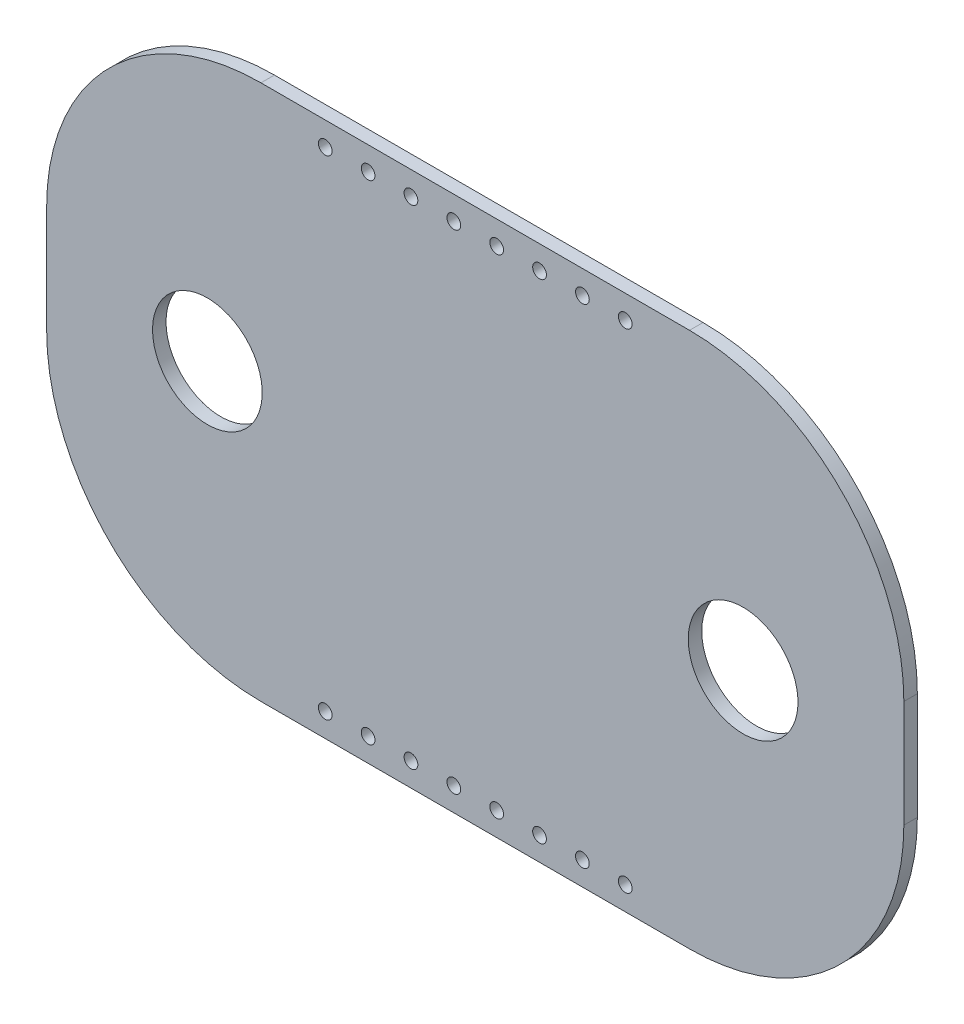
from build123d import *

# Parameters (mm, degrees)
SKETCH1_R           = 3.2512
BOSS_EXTRUDE1_DEPTH = 0.800000051
SKETCH3_R           = 0.4064
CUT_EXTRUDE3_DEPTH  = 53.080016562


with BuildPart() as part:
    # Sketch1 → Boss-Extrude1 (new body)
    with BuildSketch(Plane.XY):
        with BuildLine():
            Line((28.575, 31.75), (3.175, 31.75))
            ThreePointArc((3.175, 31.75), (-5.805256121, 28.030256121), (-9.525, 19.05))
            Line((-9.525, 19.05), (-9.525, 12.7))
            ThreePointArc((-9.525, 12.7), (-5.805256121, 3.719743879), (3.175, 0))
            Line((3.175, 0), (28.575, 0))
            ThreePointArc((28.575, 0), (37.555256121, 3.719743879), (41.275, 12.7))
            Line((41.275, 12.7), (41.275, 19.05))
            ThreePointArc((41.275, 19.05), (37.555256121, 28.030256121), (28.575, 31.75))
        make_face()
        with Locations(Location((0, 15.875, 0), (0, 0, 180))):
            Circle(SKETCH1_R, mode=Mode.SUBTRACT)
        with Locations(Location((31.75, 15.875, 0), (0, 0, 180))):
            Circle(SKETCH1_R, mode=Mode.SUBTRACT)
    extrude(amount=BOSS_EXTRUDE1_DEPTH)

    # Sketch3 → Cut-Extrude3 (cut, through all)
    with BuildSketch(Plane(origin=(0, 0, 0.800000051), x_dir=(-1, 0, 0), z_dir=(0, 0, -1))):
        with Locations((-14.605, 30.353)):
            Circle(SKETCH3_R)
        with Locations((-12.065, 30.353)):
            Circle(SKETCH3_R)
        with Locations((-9.525, 30.353)):
            Circle(SKETCH3_R)
        with Locations((-6.985, 30.353)):
            Circle(SKETCH3_R)
        with Locations(Location((-24.765, 30.353, 0), (0, 0, 180))):
            Circle(SKETCH3_R)
        with Locations(Location((-22.225, 30.353, 0), (0, 0, 180))):
            Circle(SKETCH3_R)
        with Locations(Location((-19.685, 30.353, 0), (0, 0, 180))):
            Circle(SKETCH3_R)
        with Locations(Location((-17.145, 30.353, 0), (0, 0, 180))):
            Circle(SKETCH3_R)
        with Locations((-17.145, 1.397)):
            Circle(SKETCH3_R)
        with Locations((-19.685, 1.397)):
            Circle(SKETCH3_R)
        with Locations((-22.225, 1.397)):
            Circle(SKETCH3_R)
        with Locations((-24.765, 1.397)):
            Circle(SKETCH3_R)
        with Locations(Location((-6.985, 1.397, 0), (0, 0, 180))):
            Circle(SKETCH3_R)
        with Locations(Location((-9.525, 1.397, 0), (0, 0, 180))):
            Circle(SKETCH3_R)
        with Locations(Location((-12.065, 1.397, 0), (0, 0, 180))):
            Circle(SKETCH3_R)
        with Locations(Location((-14.605, 1.397, 0), (0, 0, 180))):
            Circle(SKETCH3_R)
    extrude(amount=CUT_EXTRUDE3_DEPTH, mode=Mode.SUBTRACT)


solid = part.part
